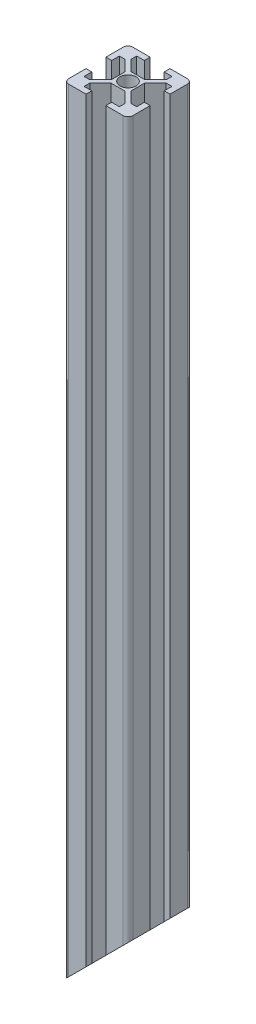
from build123d import *

# Parameters (mm, degrees)
SKETCH_1_R          = 2.5
EXTRUDE_1_DEPTH     = 242.72
CUT_EXTRUDE_1_DEPTH = 328.339480429


with BuildPart() as part:
    # 草图1 → 凸台-拉伸1 (new body)
    with BuildSketch(Plane(origin=(0, 0, 0), x_dir=(1, 0, 0), z_dir=(0, 1, 0))):
        with BuildLine():
            Line((-216.919311098, -330.148369359), (-218.719311098, -330.148369359))
            Line((-218.719311098, -330.148369359), (-218.719311098, -335.548369359))
            ThreePointArc((-218.719311098, -335.548369359), (-218.27997127, -336.60902953), (-217.219311098, -337.048369359))
            Line((-217.219311098, -337.048369359), (-211.819311098, -337.048369359))
            Line((-211.819311098, -337.048369359), (-211.819311098, -335.248369359))
            Line((-211.819311098, -335.248369359), (-214.219311098, -335.248369359))
            Line((-214.219311098, -335.248369359), (-214.219311098, -333.445419514))
            Line((-214.219311098, -333.445419514), (-210.922260943, -330.148369359))
            Line((-210.922260943, -330.148369359), (-206.516361253, -330.148369359))
            Line((-206.516361253, -330.148369359), (-203.219311098, -333.445419514))
            Line((-203.219311098, -333.445419514), (-203.219311098, -335.248369359))
            Line((-203.219311098, -335.248369359), (-205.619311098, -335.248369359))
            Line((-205.619311098, -335.248369359), (-205.619311098, -337.048369359))
            Line((-205.619311098, -337.048369359), (-200.219311098, -337.048369359))
            ThreePointArc((-200.219311098, -337.048369359), (-199.158650926, -336.60902953), (-198.719311098, -335.548369359))
            Line((-198.719311098, -335.548369359), (-198.719311098, -330.148369359))
            Line((-198.719311098, -330.148369359), (-200.519311098, -330.148369359))
            Line((-200.519311098, -330.148369359), (-200.519311098, -332.548369359))
            Line((-200.519311098, -332.548369359), (-202.322260943, -332.548369359))
            Line((-202.322260943, -332.548369359), (-205.665184078, -329.205446224))
            Line((-205.665184078, -329.205446224), (-205.665184078, -324.891292493))
            Line((-205.665184078, -324.891292493), (-202.322260943, -321.548369359))
            Line((-202.322260943, -321.548369359), (-200.519311098, -321.548369359))
            Line((-200.519311098, -321.548369359), (-200.519311098, -323.948369359))
            Line((-200.519311098, -323.948369359), (-198.719311098, -323.948369359))
            Line((-198.719311098, -323.948369359), (-198.719311098, -318.548369359))
            ThreePointArc((-198.719311098, -318.548369359), (-199.158650926, -317.487709187), (-200.219311098, -317.048369359))
            Line((-200.219311098, -317.048369359), (-205.619311098, -317.048369359))
            Line((-205.619311098, -317.048369359), (-205.619311098, -318.848369359))
            Line((-205.619311098, -318.848369359), (-203.219311098, -318.848369359))
            Line((-203.219311098, -318.848369359), (-203.219311098, -320.651319203))
            Line((-203.219311098, -320.651319203), (-206.516361253, -323.948369359))
            Line((-206.516361253, -323.948369359), (-210.922260943, -323.948369359))
            Line((-210.922260943, -323.948369359), (-214.219311098, -320.651319203))
            Line((-214.219311098, -320.651319203), (-214.219311098, -318.848369359))
            Line((-214.219311098, -318.848369359), (-211.819311098, -318.848369359))
            Line((-211.819311098, -318.848369359), (-211.819311098, -317.048369359))
            Line((-211.819311098, -317.048369359), (-217.219311098, -317.048369359))
            ThreePointArc((-217.219311098, -317.048369359), (-218.27997127, -317.487709187), (-218.719311098, -318.548369359))
            Line((-218.719311098, -318.548369359), (-218.719311098, -323.948369359))
            Line((-218.719311098, -323.948369359), (-216.919311098, -323.948369359))
            Line((-216.919311098, -323.948369359), (-216.919311098, -321.548369359))
            Line((-216.919311098, -321.548369359), (-215.116361253, -321.548369359))
            Line((-215.116361253, -321.548369359), (-211.773438118, -324.891292493))
            Line((-211.773438118, -324.891292493), (-211.773438118, -329.205446224))
            Line((-211.773438118, -329.205446224), (-215.116361253, -332.548369359))
            Line((-215.116361253, -332.548369359), (-216.919311098, -332.548369359))
            Line((-216.919311098, -332.548369359), (-216.919311098, -330.148369359))
        make_face()
        with Locations(Location((-208.719311098, -327.048369359, 0), (0, 0, 270))):
            Circle(SKETCH_1_R, mode=Mode.SUBTRACT)
    extrude(amount=EXTRUDE_1_DEPTH)

    # 草图2 → 切除-拉伸1 (cut, through all)
    with BuildSketch(Plane.XY.offset(337.048369359)):
        Polygon((-218.719311098, 0), (-198.719311098, 20), (-198.719311098, 0), align=None)
    extrude(amount=-CUT_EXTRUDE_1_DEPTH, mode=Mode.SUBTRACT)


solid = part.part
